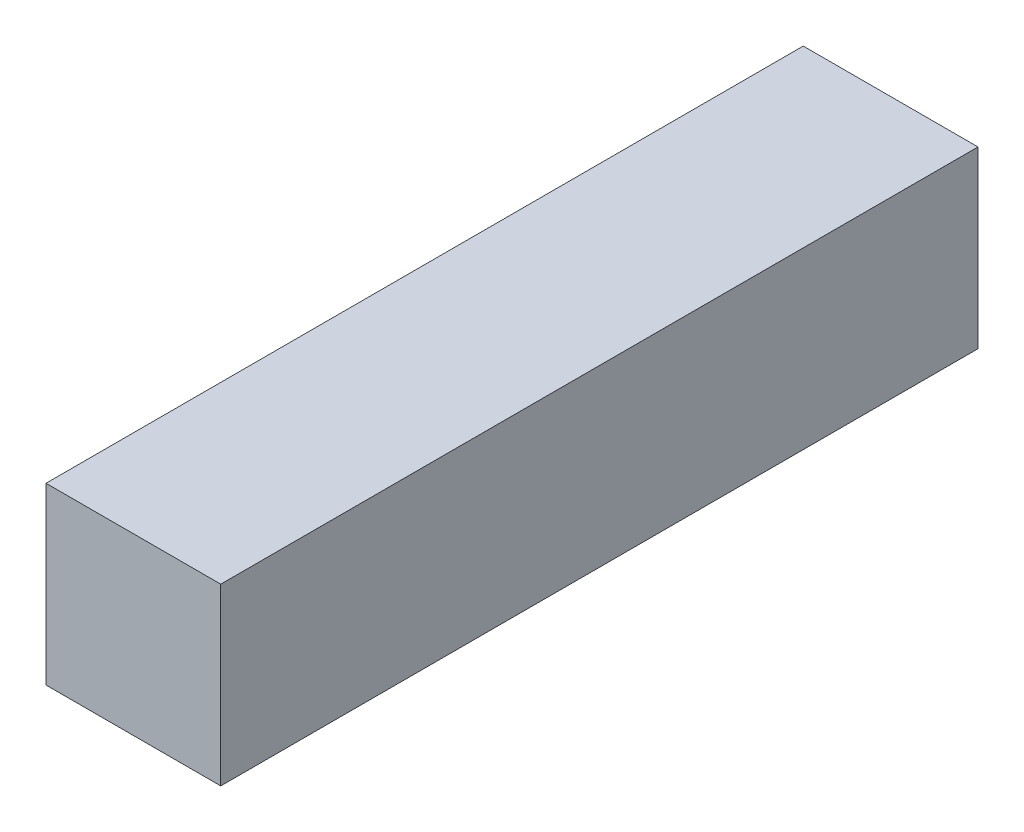
from build123d import *

# Parameters (mm, degrees)
SKETCH1_W           = 30
SKETCH1_H           = 30
BOSS_EXTRUDE1_DEPTH = 65


with BuildPart() as part:
    # Sketch1 → Boss-Extrude1 (new, symmetric)
    with BuildSketch(Plane.XY):
        Rectangle(SKETCH1_W, SKETCH1_H)
    extrude(amount=BOSS_EXTRUDE1_DEPTH, both=True)


solid = part.part
